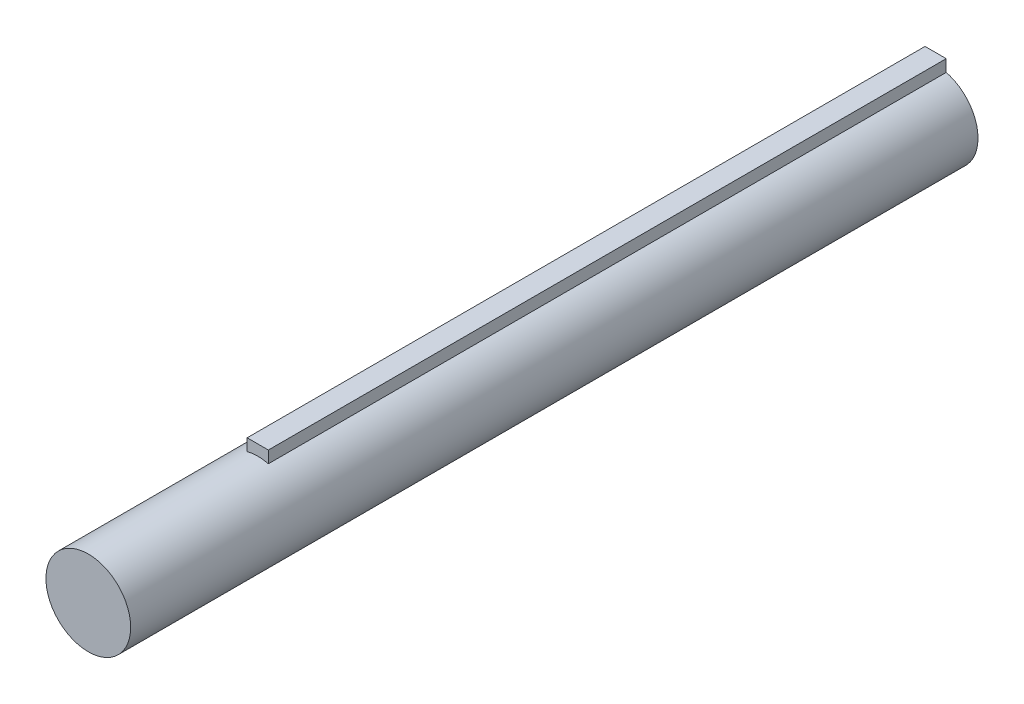
from build123d import *

# Parameters (mm, degrees)
SKETCH1_R           = 10
BOSS_EXTRUDE1_DEPTH = 200
BOSS_EXTRUDE2_DEPTH = 160


with BuildPart() as part:
    # Sketch1 → Boss-Extrude1 (new body)
    with BuildSketch(Plane.XY):
        Circle(SKETCH1_R)
    extrude(amount=BOSS_EXTRUDE1_DEPTH)


with BuildPart() as body_2:
    # Sketch2 → Boss-Extrude2 (new body)
    with BuildSketch(Plane(origin=(0, 0, 0), x_dir=(-1, 0, 0), z_dir=(0, 0, -1))):
        with BuildLine():
            Line((2.5, 12.5), (-2.5, 12.5))
            Line((-2.5, 12.5), (-2.5, 9.682458366))
            ThreePointArc((-2.5, 9.682458366), (0, 10), (2.5, 9.682458366))
            Line((2.5, 9.682458366), (2.5, 12.5))
        make_face()
    extrude(amount=-BOSS_EXTRUDE2_DEPTH)


solid = Compound([part.part, body_2.part])
